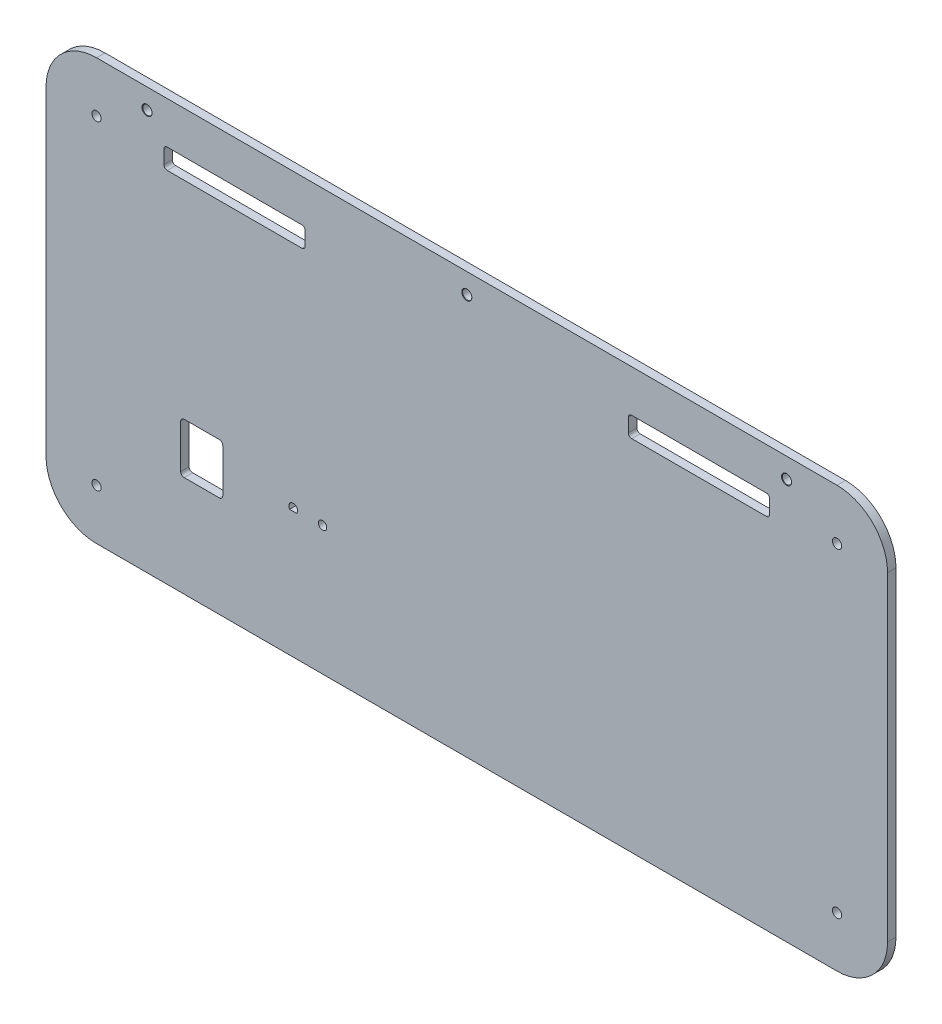
from build123d import *

# Parameters (mm, degrees)
BOSS_EXTRU_1_DEPTH         = 5
D_GAGEMENT_M51_D           = 5.5
D_GAGEMENT_M51_CSINK_D     = 5.55
D_GAGEMENT_M51_CSINK_ANGLE = 90
ENL_V_MAT_EXTRU_1_DEPTH    = 560.039354608
D_GAGEMENT_M52_D           = 5.5
D_GAGEMENT_M52_CSINK_D     = 6
D_GAGEMENT_M52_CSINK_ANGLE = 90
ENL_V_MAT_EXTRU_2_DEPTH    = 560.039354608
ENL_V_MAT_EXTRU_3_DEPTH    = 560.039354608
ESQUISSE15_R               = 2.5
ENL_V_MAT_EXTRU_4_DEPTH    = 560.039354608


with BuildPart() as part:
    # Esquisse1 → Boss.-Extru.1 (new body)
    with BuildSketch(Plane.XY):
        with BuildLine():
            Line((30, 0), (470, 0))
            ThreePointArc((470, 0), (491.213203436, 8.786796564), (500, 30))
            Line((500, 30), (500, 220))
            ThreePointArc((500, 220), (491.213203436, 241.213203436), (470, 250))
            Line((470, 250), (30, 250))
            ThreePointArc((30, 250), (8.786796564, 241.213203436), (0, 220))
            Line((0, 220), (0, 30))
            ThreePointArc((0, 30), (8.786796564, 8.786796564), (30, 0))
        make_face()
    extrude(amount=BOSS_EXTRU_1_DEPTH)

    # Dégagement M51 (through all)
    with Locations(Plane(origin=(0, 0, 0), x_dir=(-1, 0, 0), z_dir=(0, 0, -1))):
        with Locations((-470, 220), (-470, 30), (-30, 30), (-30, 220)):
            CounterSinkHole(D_GAGEMENT_M51_D / 2, D_GAGEMENT_M51_CSINK_D / 2, counter_sink_angle=D_GAGEMENT_M51_CSINK_ANGLE)

    # Esquisse8 → Enlèv. mat.-Extru.1 (cut, through all)
    with BuildSketch(Plane.XY.offset(5)):
        with BuildLine():
            Line((72, 225), (152, 225))
            ThreePointArc((152, 225), (153.414213562, 224.414213562), (154, 223))
            Line((154, 223), (154, 215))
            ThreePointArc((154, 215), (153.414213562, 213.585786438), (152, 213))
            Line((152, 213), (72, 213))
            ThreePointArc((72, 213), (70.585786438, 213.585786438), (70, 215))
            Line((70, 215), (70, 223))
            ThreePointArc((70, 223), (70.585786438, 224.414213562), (72, 225))
        make_face()
        with BuildLine():
            Line((346, 223), (346, 215))
            ThreePointArc((346, 215), (346.585786438, 213.585786438), (348, 213))
            Line((348, 213), (428, 213))
            ThreePointArc((428, 213), (429.414213562, 213.585786438), (430, 215))
            Line((430, 215), (430, 223))
            ThreePointArc((430, 223), (429.414213562, 224.414213562), (428, 225))
            Line((428, 225), (348, 225))
            ThreePointArc((348, 225), (346.585786438, 224.414213562), (346, 223))
        make_face()
    extrude(amount=-ENL_V_MAT_EXTRU_1_DEPTH, mode=Mode.SUBTRACT)

    # Dégagement M52 (through all)
    with Locations(Plane.XY.offset(5)):
        with Locations((60, 238), (440, 238), (250, 238)):
            CounterSinkHole(D_GAGEMENT_M52_D / 2, D_GAGEMENT_M52_CSINK_D / 2, counter_sink_angle=D_GAGEMENT_M52_CSINK_ANGLE)

    # Esquisse13 → Enlèv. mat.-Extru.2 (cut, through all)
    with BuildSketch(Plane(origin=(0, 0, 0), x_dir=(-1, 0, 0), z_dir=(0, 0, -1))):
        with BuildLine():
            Line((-105, 88), (-105, 62))
            ThreePointArc((-105, 62), (-104.414213562, 60.585786438), (-103, 60))
            Line((-103, 60), (-82, 60))
            ThreePointArc((-82, 60), (-80.585786438, 60.585786438), (-80, 62))
            Line((-80, 62), (-80, 88))
            ThreePointArc((-80, 88), (-80.585786438, 89.414213562), (-82, 90))
            Line((-82, 90), (-103, 90))
            ThreePointArc((-103, 90), (-104.414213562, 89.414213562), (-105, 88))
        make_face()
    extrude(amount=-ENL_V_MAT_EXTRU_2_DEPTH, mode=Mode.SUBTRACT)

    # Esquisse14 → Enlèv. mat.-Extru.3 (cut, through all)
    with BuildSketch(Plane.XY.offset(5)):
        with BuildLine():
            Line((144.742586668, 75), (148.952586668, 75))
            ThreePointArc((148.952586668, 75), (146.847586668, 79.179927883), (144.742586668, 75))
        make_face()
    extrude(amount=-ENL_V_MAT_EXTRU_3_DEPTH, mode=Mode.SUBTRACT)

    # Esquisse15 → Enlèv. mat.-Extru.4 (cut, through all)
    with BuildSketch(Plane.XY.offset(5)):
        with Locations((164.292422871, 76.559927883)):
            Circle(ESQUISSE15_R)
    extrude(amount=-ENL_V_MAT_EXTRU_4_DEPTH, mode=Mode.SUBTRACT)


solid = part.part
